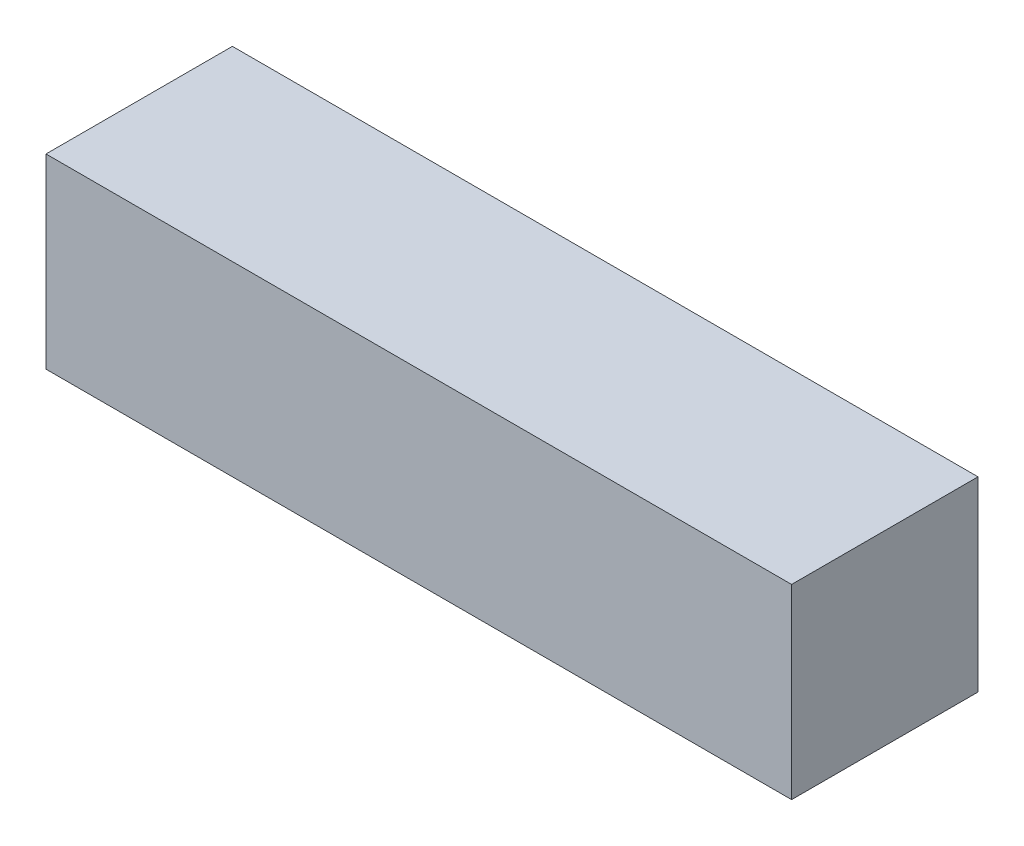
from build123d import *

# Parameters (mm, degrees)
SKETCH1_W           = 100
SKETCH1_H           = 100
BOSS_EXTRUDE1_DEPTH = 400
SKETCH2_R           = 4
CUT_EXTRUDE1_DEPTH  = 10


with BuildPart() as part:
    # Sketch1 → Boss-Extrude1 (new body)
    with BuildSketch(Plane(origin=(0, 0, 0), x_dir=(0, 0, -1), z_dir=(1, 0, 0))):
        Rectangle(SKETCH1_W, SKETCH1_H)
    extrude(amount=BOSS_EXTRUDE1_DEPTH)

    # Sketch2 → Cut-Extrude1 (cut)
    with BuildSketch(Plane.ZY):
        Circle(SKETCH2_R)
    extrude(amount=-CUT_EXTRUDE1_DEPTH, mode=Mode.SUBTRACT)


solid = part.part
